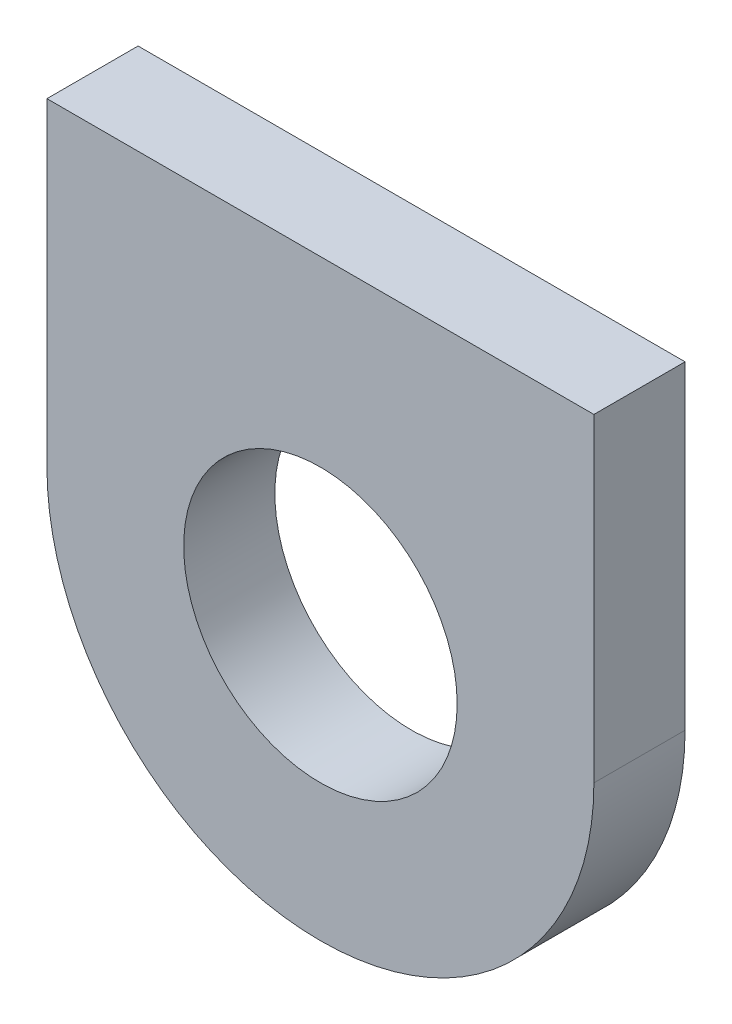
from build123d import *

# Parameters (mm, degrees)
SKETCH1_R           = 15
BOSS_EXTRUDE1_DEPTH = 10


with BuildPart() as part:
    # Sketch1 → Boss-Extrude1 (new body)
    with BuildSketch(Plane.XY):
        with BuildLine():
            Line((-30, 0), (-30, 35))
            Line((-30, 35), (30, 35))
            Line((30, 35), (30, 0))
            ThreePointArc((30, 0), (0, -30), (-30, 0))
        make_face()
        Circle(SKETCH1_R, mode=Mode.SUBTRACT)
    extrude(amount=BOSS_EXTRUDE1_DEPTH)


solid = part.part
